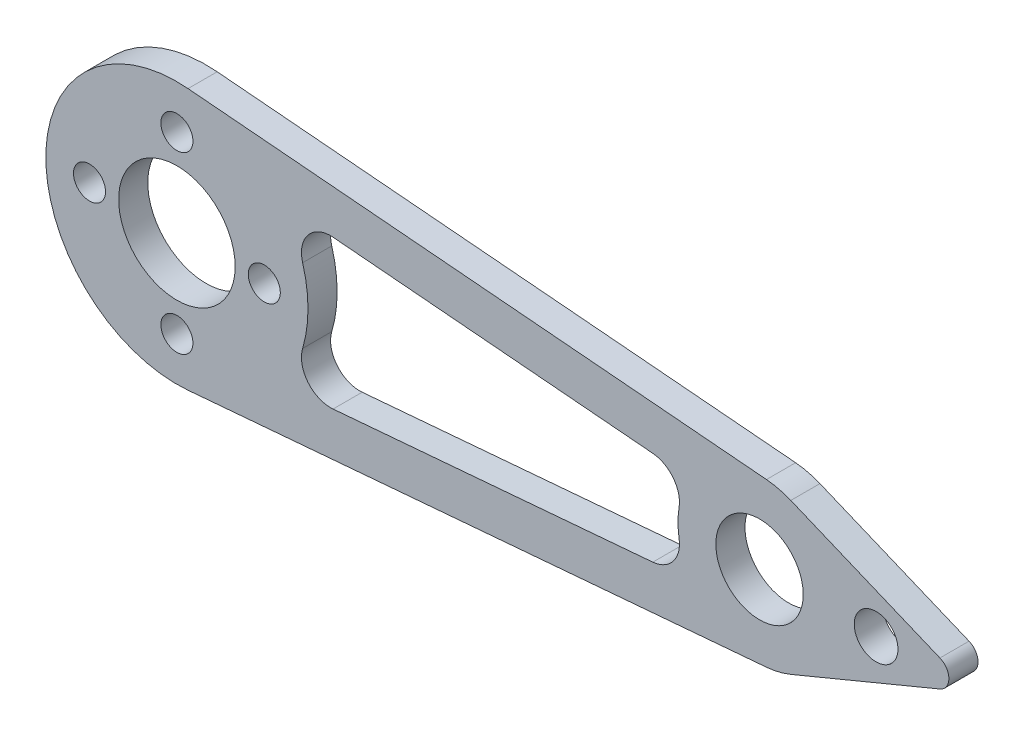
from build123d import *

# Parameters (mm, degrees)
ESQUISSE1_R             = 9
ESQUISSE1_R_2           = 1.1
ESQUISSE1_R_3           = 4
BOSS_EXTRU_1_DEPTH      = 2
BOSS_EXTRU_2_START      = -2
ESQUISSE2_R             = 3
BOSS_EXTRU_2_DEPTH      = 2
ENL_V_MAT_EXTRU_1_DEPTH = 47.52268264
CONG_1_R                = 2
ESQUISSE4_R             = 1.5
BOSS_EXTRU_3_DEPTH      = 2


with BuildPart() as part:
    # Esquisse1 → Boss.-Extru.1 (new body)
    with BuildSketch(Plane.XY):
        Circle(ESQUISSE1_R)
        with Locations((0, 6)):
            Circle(ESQUISSE1_R_2, mode=Mode.SUBTRACT)
        with Locations((6, 0)):
            Circle(ESQUISSE1_R_2, mode=Mode.SUBTRACT)
        with Locations((0, -6)):
            Circle(ESQUISSE1_R_2, mode=Mode.SUBTRACT)
        with Locations((-6, 0)):
            Circle(ESQUISSE1_R_2, mode=Mode.SUBTRACT)
        Circle(ESQUISSE1_R_3, mode=Mode.SUBTRACT)
    extrude(amount=BOSS_EXTRU_1_DEPTH)

    # Esquisse2 → Boss.-Extru.2 (add)
    with BuildSketch(Plane.XY.offset(2).offset(BOSS_EXTRU_2_START)):
        with BuildLine():
            Line((0.765, 8.967428561), (40.476, 5.579733327))
            ThreePointArc((40.476, 5.579733327), (45.6, 0), (40.476, -5.579733327))
            Line((40.476, -5.579733327), (0.765, -8.967428561))
            ThreePointArc((0.765, -8.967428561), (9, 0), (0.765, 8.967428561))
        make_face()
        with Locations((40, 0)):
            Circle(ESQUISSE2_R, mode=Mode.SUBTRACT)
    extrude(amount=BOSS_EXTRU_2_DEPTH)

    # Esquisse3 → Enlèv. mat.-Extru.1 (cut, through all)
    with BuildSketch(Plane.XY.offset(2)):
        with BuildLine():
            Line((7.193926615, 5.408088373), (35.279111191, 3.012176763))
            ThreePointArc((35.279111191, 3.012176763), (34.4, 0), (35.279111191, -3.012176763))
            Line((35.279111191, -3.012176763), (7.193926615, -5.408088373))
            ThreePointArc((7.193926615, -5.408088373), (9, 0), (7.193926615, 5.408088373))
        make_face()
    extrude(amount=-ENL_V_MAT_EXTRU_1_DEPTH, mode=Mode.SUBTRACT)

    # Congé1
    cong_1_edges = [part.edges().sort_by_distance(p)[0] for p in [
        (7.193926615, -5.408088373, 1),
        (7.193926615, 5.408088373, 1),
        (35.279111191, 3.012176763, 1),
        (35.279111191, -3.012176763, 1),
    ]]
    fillet(cong_1_edges, radius=CONG_1_R)

    # Esquisse4 → Boss.-Extru.3 (add)
    with BuildSketch(Plane.XY.offset(2)):
        with BuildLine():
            Line((42.146666667, 5.172216374), (52.383333333, 0.923610067))
            ThreePointArc((52.383333333, 0.923610067), (53, 0), (52.383333333, -0.923610067))
            Line((52.383333333, -0.923610067), (42.146666667, -5.172216374))
            ThreePointArc((42.146666667, -5.172216374), (45.6, 0), (42.146666667, 5.172216374))
        make_face()
        with Locations((48, 0)):
            Circle(ESQUISSE4_R, mode=Mode.SUBTRACT)
    extrude(amount=-BOSS_EXTRU_3_DEPTH)


solid = part.part
